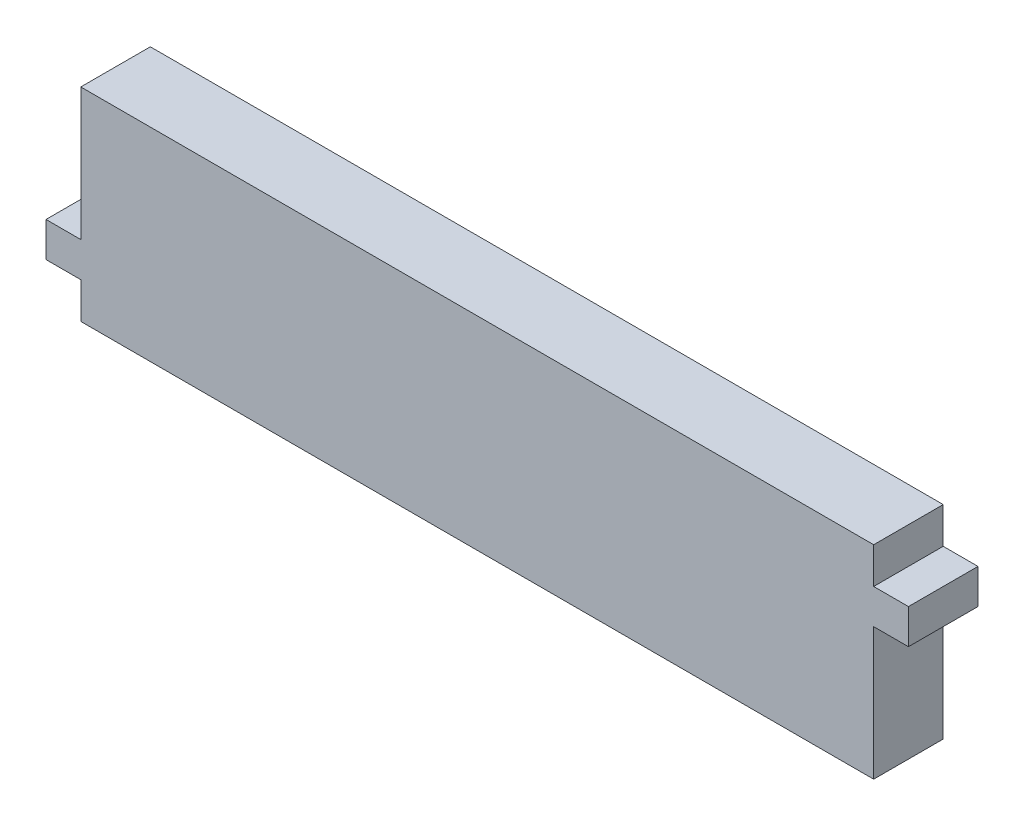
from build123d import *

# Parameters (mm, degrees)
BOSS_EXTRUDE1_DEPTH = 6.35


with BuildPart() as part:
    # Sketch4 → Boss-Extrude1 (new body)
    with BuildSketch(Plane.XY):
        Polygon((129.113772097, -14.485267498), (132.288772097, -14.485267498), (132.288772097, -17.660267498), (129.113772097, -17.660267498), (129.113772097, -23.248267498), (129.113772097, -26.423267498), (129.113772097, -29.725267498), (56.723772097, -29.725267498), (56.723772097, -26.423267498), (53.548772097, -26.423267498), (53.548772097, -23.248267498), (56.723772097, -23.248267498), (56.723772097, -11.183267498), (129.113772097, -11.183267498), align=None)
    extrude(amount=BOSS_EXTRUDE1_DEPTH)


solid = part.part
